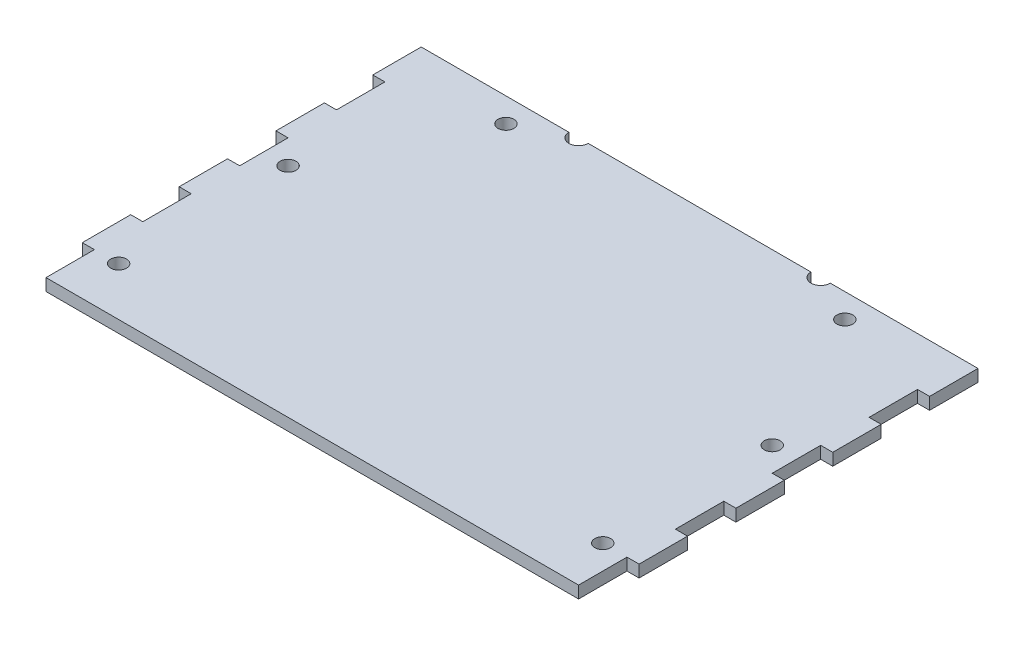
from build123d import *

# Parameters (mm, degrees)
SKETCH2_R           = 2.0828
BOSS_EXTRUDE1_DEPTH = 3.175


with BuildPart() as part:
    # Sketch2 → Boss-Extrude1 (new body)
    with BuildSketch(Plane(origin=(0, 0, 0), x_dir=(1, 0, 0), z_dir=(0, 1, 0))):
        with BuildLine():
            Line((3.175, 0), (3.175, 12.7))
            Line((3.175, 12.7), (0, 12.7))
            Line((0, 12.7), (0, 25.4))
            Line((0, 25.4), (3.175, 25.4))
            Line((3.175, 25.4), (3.175, 38.1))
            Line((3.175, 38.1), (0, 38.1))
            Line((0, 38.1), (0, 50.8))
            Line((0, 50.8), (3.175, 50.8))
            Line((3.175, 50.8), (3.175, 63.5))
            Line((3.175, 63.5), (0, 63.5))
            Line((0, 63.5), (0, 76.2))
            Line((0, 76.2), (3.175, 76.2))
            Line((3.175, 76.2), (3.175, 88.9))
            Line((3.175, 88.9), (0, 88.9))
            Line((0, 88.9), (0, 101.6))
            Line((0, 101.6), (3.175, 101.6))
            Line((3.175, 101.6), (38.735, 101.6))
            ThreePointArc((38.735, 101.6), (41.275, 99.06), (43.815, 101.6))
            Line((43.815, 101.6), (102.235, 101.6))
            ThreePointArc((102.235, 101.6), (104.775, 99.06), (107.315, 101.6))
            Line((107.315, 101.6), (142.875, 101.6))
            Line((142.875, 101.6), (146.05, 101.6))
            Line((146.05, 101.6), (146.05, 88.9))
            Line((146.05, 88.9), (142.875, 88.9))
            Line((142.875, 88.9), (142.875, 76.2))
            Line((142.875, 76.2), (146.05, 76.2))
            Line((146.05, 76.2), (146.05, 63.5))
            Line((146.05, 63.5), (142.875, 63.5))
            Line((142.875, 63.5), (142.875, 50.8))
            Line((142.875, 50.8), (146.05, 50.8))
            Line((146.05, 50.8), (146.05, 38.1))
            Line((146.05, 38.1), (142.875, 38.1))
            Line((142.875, 38.1), (142.875, 25.4))
            Line((142.875, 25.4), (146.05, 25.4))
            Line((146.05, 25.4), (146.05, 12.7))
            Line((146.05, 12.7), (142.875, 12.7))
            Line((142.875, 12.7), (142.875, 0))
            Line((142.875, 0), (3.175, 0))
        make_face()
        with Locations(Location((136.525, 57.15, 0), (0, 0, 90))):
            Circle(SKETCH2_R, mode=Mode.SUBTRACT)
        with Locations(Location((9.525, 12.7, 0), (0, 0, 270))):
            Circle(SKETCH2_R, mode=Mode.SUBTRACT)
        with Locations(Location((9.525, 57.15, 0), (0, 0, 270))):
            Circle(SKETCH2_R, mode=Mode.SUBTRACT)
        with Locations(Location((136.525, 12.7, 0), (0, 0, 90))):
            Circle(SKETCH2_R, mode=Mode.SUBTRACT)
        with Locations(Location((28.575, 95.25, 0), (0, 0, 270))):
            Circle(SKETCH2_R, mode=Mode.SUBTRACT)
        with Locations(Location((117.475, 95.25, 0), (0, 0, 90))):
            Circle(SKETCH2_R, mode=Mode.SUBTRACT)
    extrude(amount=BOSS_EXTRUDE1_DEPTH)


solid = part.part
